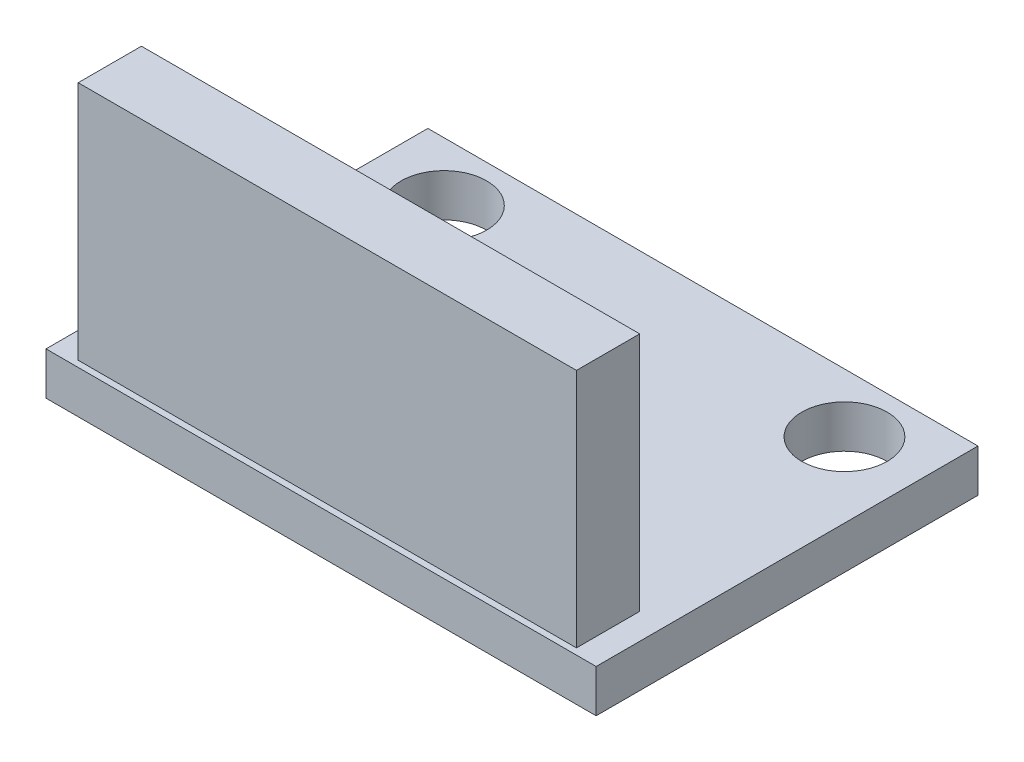
from build123d import *

# Parameters (mm, degrees)
SKETCH1_W           = 20.6
SKETCH1_H           = 14.3
SKETCH1_R           = 1.6
BOSS_EXTRUDE1_DEPTH = 1.6
SKETCH2_W           = 18.658076696
SKETCH2_H           = 2.368570216
BOSS_EXTRUDE2_DEPTH = 9


with BuildPart() as part:
    # Sketch1 → Boss-Extrude1 (new body)
    with BuildSketch(Plane(origin=(0, 0, 0), x_dir=(1, 0, 0), z_dir=(0, 1, 0))):
        Rectangle(SKETCH1_W, SKETCH1_H)
        with Locations(Location((-7.5, 4.95, 0), (0, 0, 270))):
            Circle(SKETCH1_R, mode=Mode.SUBTRACT)
        with Locations(Location((7.5, 4.95, 0), (0, 0, 270))):
            Circle(SKETCH1_R, mode=Mode.SUBTRACT)
    extrude(amount=BOSS_EXTRUDE1_DEPTH)

    # Sketch2 → Boss-Extrude2 (add)
    with BuildSketch(Plane(origin=(0, 1.6, 0), x_dir=(1, 0, 0), z_dir=(0, 1, 0))):
        with Locations((0, -5.731493021)):
            Rectangle(SKETCH2_W, SKETCH2_H)
    extrude(amount=BOSS_EXTRUDE2_DEPTH)


solid = part.part
